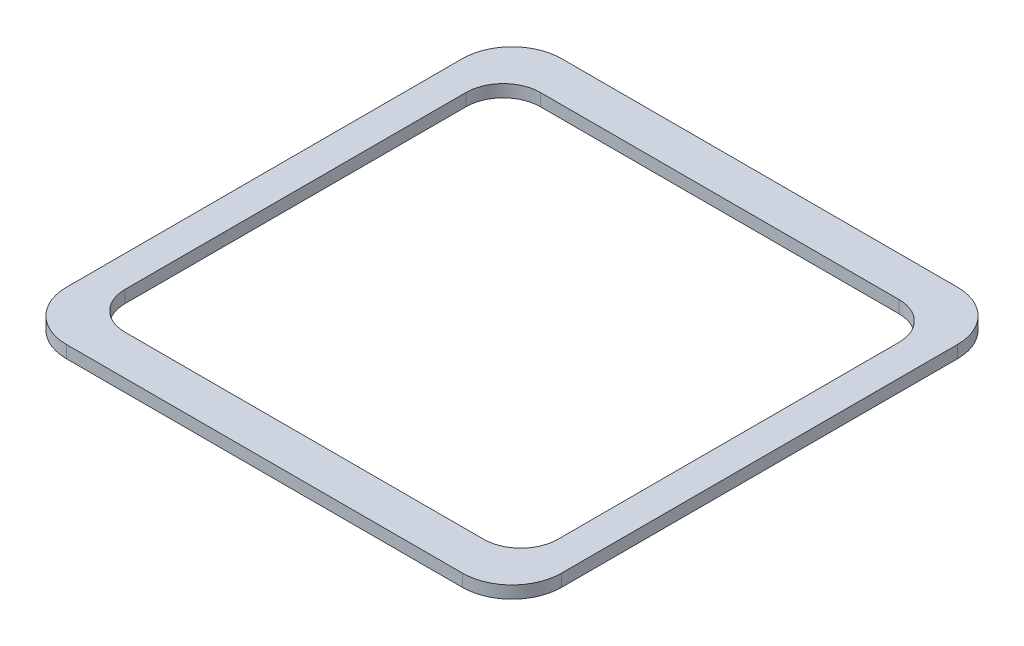
from build123d import *

# Parameters (mm, degrees)
MAINBODY_DEPTH = 3.175


with BuildPart() as part:
    # Sketch2 → MainBody (new body)
    with BuildSketch(Plane(origin=(0, 49.342738419, 0), x_dir=(1, 0, 0), z_dir=(0, 1, 0))):
        with BuildLine():
            Line((36.612473168, 86.646627483), (-64.987526832, 86.646627483))
            ThreePointArc((-64.987526832, 86.646627483), (-73.967782953, 82.926883604), (-77.687526832, 73.946627483))
            Line((-77.687526832, 73.946627483), (-77.687526832, -27.653372517))
            ThreePointArc((-77.687526832, -27.653372517), (-73.967782953, -36.633628639), (-64.987526832, -40.353372517))
            Line((-64.987526832, -40.353372517), (36.612473168, -40.353372517))
            ThreePointArc((36.612473168, -40.353372517), (45.592729289, -36.633628639), (49.312473168, -27.653372517))
            Line((49.312473168, -27.653372517), (49.312473168, 73.946627483))
            ThreePointArc((49.312473168, 73.946627483), (45.592729289, 82.926883604), (36.612473168, 86.646627483))
        make_face()
        with BuildLine():
            Line((-60.179746039, -30.115902517), (31.804692375, -30.115902517))
            ThreePointArc((31.804692375, -30.115902517), (38.53898644, -27.326466583), (41.328422375, -20.592172517))
            Line((41.328422375, -20.592172517), (41.328422375, 66.885427483))
            ThreePointArc((41.328422375, 66.885427483), (38.53898644, 73.619721548), (31.804692375, 76.409157483))
            Line((31.804692375, 76.409157483), (-60.179746039, 76.409157483))
            ThreePointArc((-60.179746039, 76.409157483), (-66.914040104, 73.619721548), (-69.703476039, 66.885427483))
            Line((-69.703476039, 66.885427483), (-69.703476039, 23.146627483))
            Line((-69.703476039, 23.146627483), (-69.703476039, -20.592172517))
            ThreePointArc((-69.703476039, -20.592172517), (-66.914040104, -27.326466583), (-60.179746039, -30.115902517))
        make_face(mode=Mode.SUBTRACT)
    extrude(amount=MAINBODY_DEPTH)


solid = part.part
